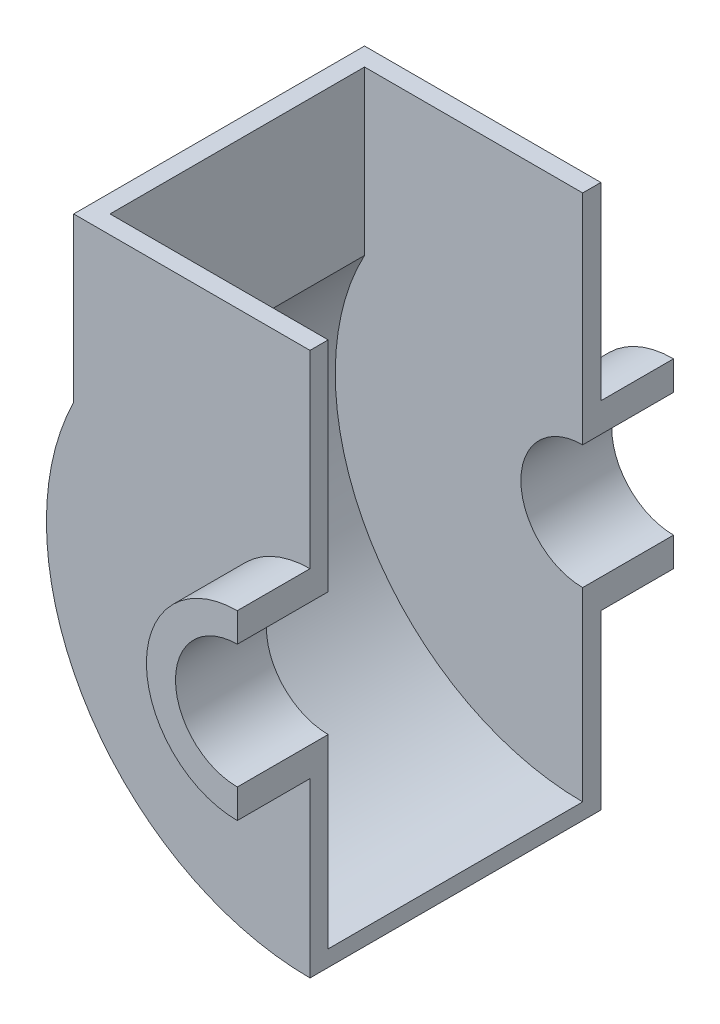
from build123d import *

# Parameters (mm, degrees)
BOSS_EXTRUDE1_DEPTH      = 20
BOSS_EXTRUDE1_DEPTH_BACK = 5
BOSS_EXTRUDE2_START      = -5
BOSS_EXTRUDE2_DEPTH      = 5
BOSS_EXTRUDE3_REACH      = 144.163


with BuildPart() as part:
    # Sketch1 → Boss-Extrude1 (new, two sides: drawn at the far end of the back side and taken through both)
    with BuildSketch(Plane.XY.offset(-BOSS_EXTRUDE1_DEPTH_BACK)):
        with BuildLine():
            Line((0, 25), (0, 17))
            ThreePointArc((0, 17), (-17, 0), (0, -17))
            Line((0, -17), (0, -25))
            ThreePointArc((0, -25), (-25, 0), (0, 25))
        make_face()
    extrude(amount=BOSS_EXTRUDE1_DEPTH + BOSS_EXTRUDE1_DEPTH_BACK)

    # Sketch2 → Boss-Extrude2 (add)
    with BuildSketch(Plane.XY.offset(BOSS_EXTRUDE2_START)):
        with BuildLine():
            ThreePointArc((0, 25), (-25, 0), (0, -25))
            Line((0, -25), (0, -72.5))
            ThreePointArc((0, -72.5), (-61.581037686, -38.262590053), (-65, 32.113081447))
            Line((-65, 32.113081447), (-65, 77))
            Line((-65, 77), (0, 77))
            Line((0, 77), (0, 25))
        make_face()
    extrude(amount=BOSS_EXTRUDE2_DEPTH)


with BuildPart() as body_2:
    # Mirror3: mirrored copy
    add(part.part.mirror(Plane.XY.offset(-40)))

    # Sketch4 → Boss-Extrude3 (add, up to next)
    with BuildSketch(Plane(origin=(0, 0, -5), x_dir=(-1, 0, 0), z_dir=(0, 0, -1)), mode=Mode.PRIVATE) as boss_extrude3_sk1:
        with BuildLine():
            Line((65, 32.113081447), (65, 77))
            Line((65, 77), (60, 77))
            Line((60, 77), (60, 32.113081447))
            ThreePointArc((60, 32.113081447), (58.380864924, -34.970339014), (0, -68.053287944))
            Line((0, -68.053287944), (0, -72.5))
            ThreePointArc((0, -72.5), (61.581037686, -38.262590053), (65, 32.113081447))
        make_face()
    boss_extrude3_tool1 = extrude(boss_extrude3_sk1.sketch, amount=BOSS_EXTRUDE3_REACH, mode=Mode.PRIVATE) - body_2.part

    add(part.part)  # Boss-Extrude3 merges part
    add(boss_extrude3_tool1.solids().sort_by_distance((-63.33848, 54.556541, -5))[0])


solid = body_2.part
